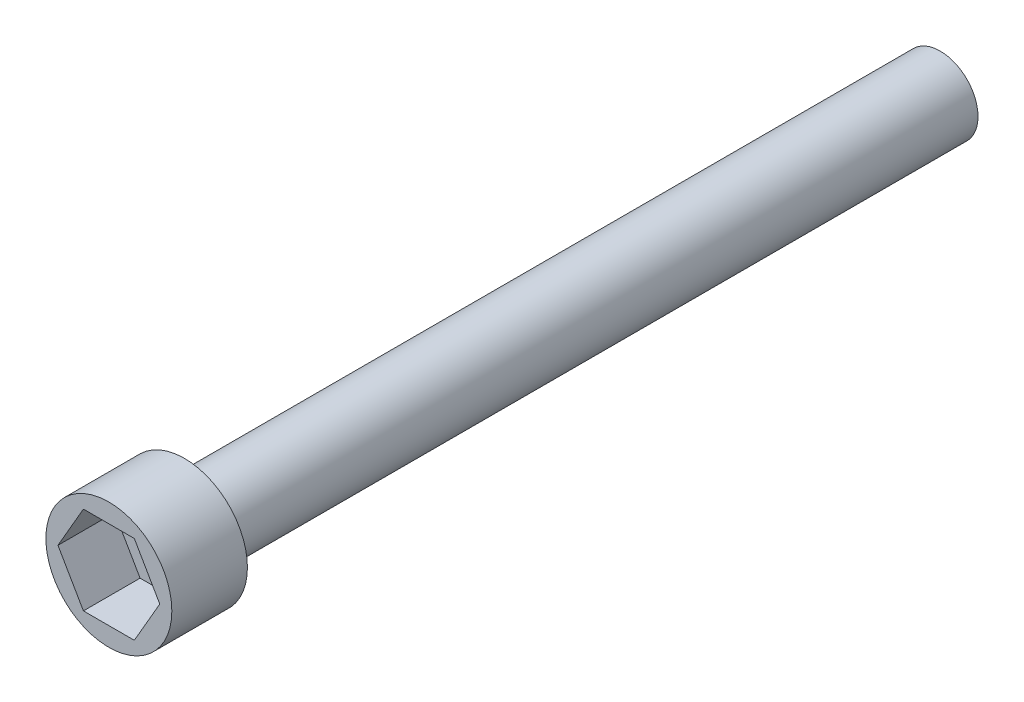
from build123d import *

# Parameters (mm, degrees)
ESQUISSE1_R             = 3
BOSS_EXTRU_1_DEPTH      = 60
ESQUISSE2_R             = 5
BOSS_EXTRU_2_DEPTH      = 6
ENL_V_MAT_EXTRU_1_DEPTH = 4.5


with BuildPart() as part:
    # Esquisse1 → Boss.-Extru.1 (new body)
    with BuildSketch(Plane.XY):
        Circle(ESQUISSE1_R)
    extrude(amount=BOSS_EXTRU_1_DEPTH)

    # Esquisse2 → Boss.-Extru.2 (add)
    with BuildSketch(Plane.XY.offset(60)):
        Circle(ESQUISSE2_R)
    extrude(amount=BOSS_EXTRU_2_DEPTH)

    # Esquisse3 → Enlèv. mat.-Extru.1 (cut)
    with BuildSketch(Plane.XY.offset(66)):
        Polygon((4.041451884, 0), (2.020725942, 3.5), (-2.020725942, 3.5), (-4.041451884, 0), (-2.020725942, -3.5), (2.020725942, -3.5), align=None)
    extrude(amount=-ENL_V_MAT_EXTRU_1_DEPTH, mode=Mode.SUBTRACT)


solid = part.part
